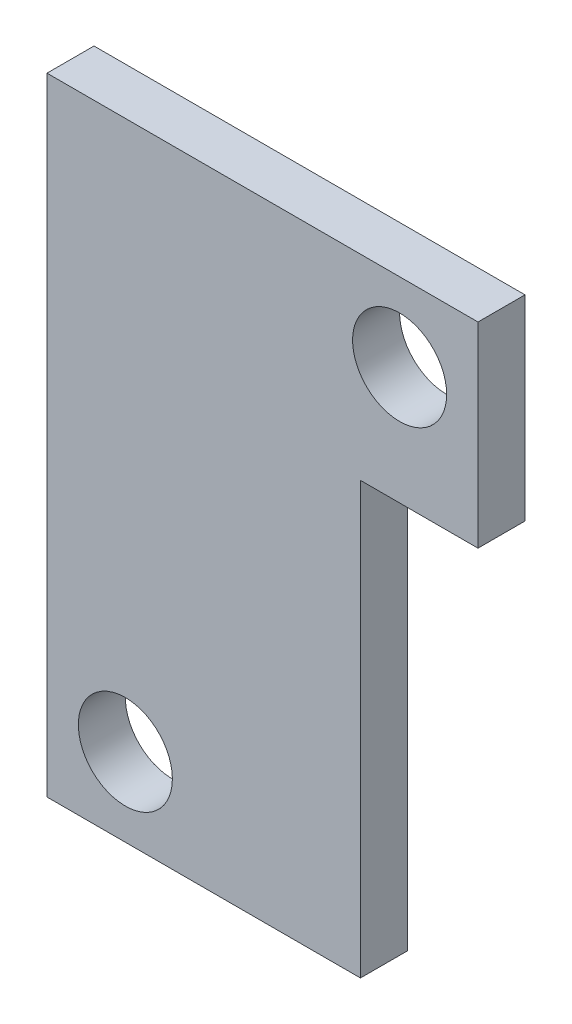
from build123d import *

# Parameters (mm, degrees)
SKETCH1_R           = 1.2
BOSS_EXTRUDE1_DEPTH = 1.2


with BuildPart() as part:
    # Sketch1 → Boss-Extrude1 (new body)
    with BuildSketch(Plane.XY):
        Polygon((8, 0), (8, 11), (11, 11), (11, 16), (0, 16), (0, 0), align=None)
        with Locations((9, 14)):
            Circle(SKETCH1_R, mode=Mode.SUBTRACT)
        with Locations((2, 2)):
            Circle(SKETCH1_R, mode=Mode.SUBTRACT)
    extrude(amount=BOSS_EXTRUDE1_DEPTH)


solid = part.part
